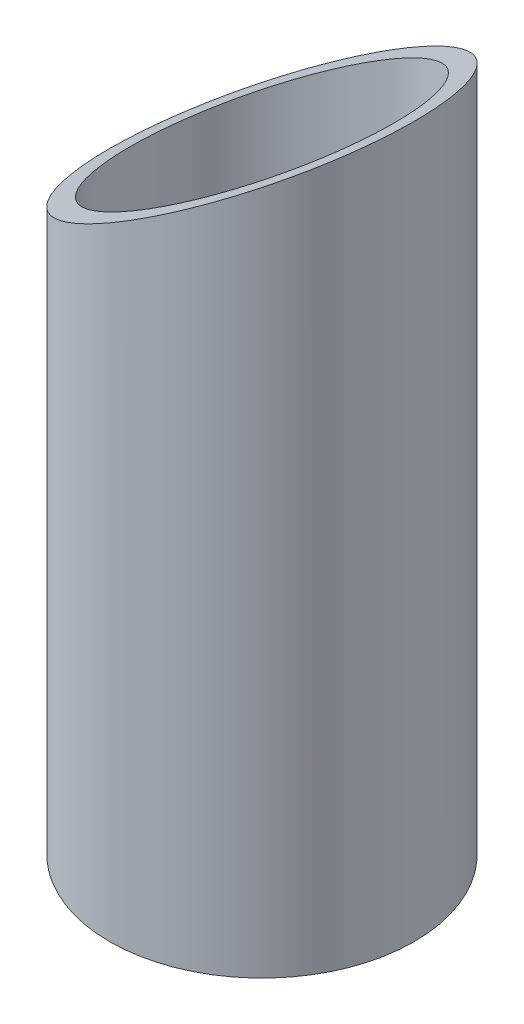
from build123d import *

# Parameters (mm, degrees)
SKETCH1_R               = 15
SKETCH1_R_2             = 13
BOSS_EXTRUDE1_DEPTH     = 70
CUT_EXTRUDE1_DEPTH      = 74.143694192
CUT_EXTRUDE1_DEPTH_BACK = 74.143694192


with BuildPart() as part:
    # Sketch1 → Boss-Extrude1 (new body)
    with BuildSketch(Plane(origin=(0, 0, 0), x_dir=(1, 0, 0), z_dir=(0, 1, 0))):
        with Locations(Location((0, 0, 0), (0, 0, 270))):
            Circle(SKETCH1_R)
        with Locations(Location((0, 0, 0), (0, 0, 270))):
            Circle(SKETCH1_R_2, mode=Mode.SUBTRACT)
    extrude(amount=BOSS_EXTRUDE1_DEPTH)

    # Sketch2 → Cut-Extrude1 (cut, two sides: drawn at the far end of the back side and taken through both)
    with BuildSketch(Plane.XY.offset(-CUT_EXTRUDE1_DEPTH_BACK)):
        Polygon((15, 70), (-15, 70), (-15, 52.679491924), align=None)
    extrude(amount=CUT_EXTRUDE1_DEPTH + CUT_EXTRUDE1_DEPTH_BACK, mode=Mode.SUBTRACT)


solid = part.part
